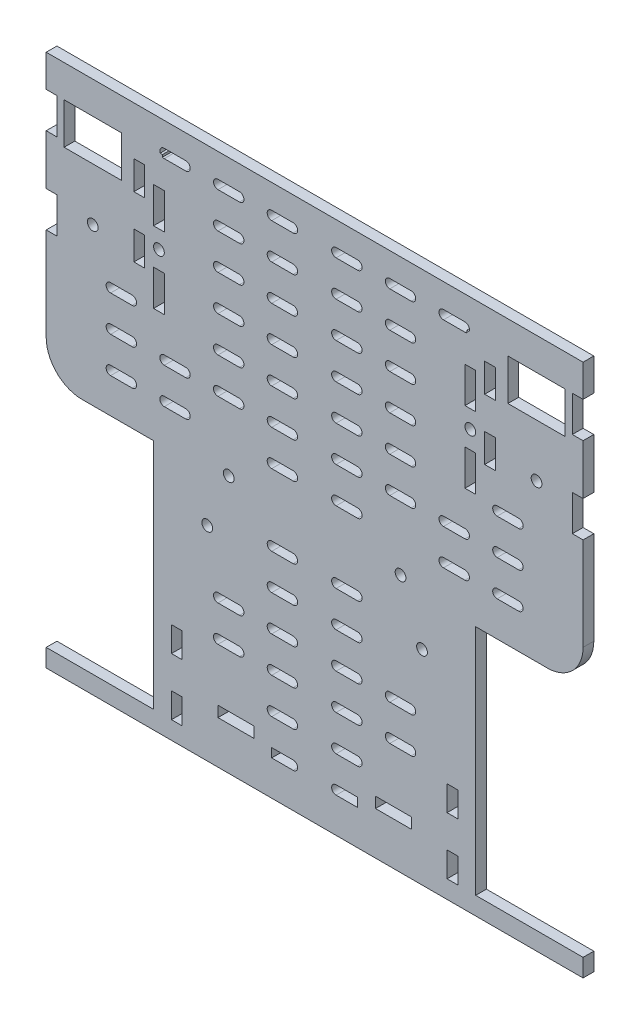
from build123d import *

# Parameters (mm, degrees)
SALIENTE_EXTRUIR1_DEPTH = 3
CROQUIS19_R             = 1.5
CROQUIS19_W             = 16
CROQUIS19_H             = 11.5
CORTAR_EXTRUIR5_DEPTH   = 5
CROQUIS35_W             = 3
CROQUIS35_H             = 7
CROQUIS35_W_2           = 10
CROQUIS35_H_2           = 3
CORTAR_EXTRUIR7_DEPTH   = 3
CROQUIS36_W             = 3
CROQUIS36_H             = 10
CORTAR_EXTRUIR8_DEPTH   = 3
CROQUIS37_R             = 1.5
CROQUIS37_W             = 3
CROQUIS37_H             = 10
CORTAR_EXTRUIR9_DEPTH   = 5
CROQUIS38_W             = 3
CROQUIS38_H             = 8
CORTAR_EXTRUIR10_DEPTH  = 10
CROQUIS45_R             = 1.5
CORTAR_EXTRUIR14_DEPTH  = 107.108435103
REDONDEO1_R             = 10
CORTAR_EXTRUIR11_DEPTH  = 10
CORTAR_EXTRUIR12_DEPTH  = 10
CROQUIS46_W             = 150
CROQUIS46_H             = 1
CORTAR_EXTRUIR15_DEPTH  = 107.108435103


with BuildPart() as part:
    # Croquis3 → Saliente-Extruir1 (new body)
    with BuildSketch(Plane.XY):
        Polygon((-75, -75), (75, -75), (75, -70), (45, -70), (45, -5), (75, -5), (75, 75), (-75, 75), (-75, -5), (-45, -5), (-45, -70), (-75, -70), align=None)
    extrude(amount=SALIENTE_EXTRUIR1_DEPTH)

    # Croquis19 → Cortar-Extruir5 (cut)
    with BuildSketch(Plane.XY):
        with Locations((-62, 38.75)):
            Circle(CROQUIS19_R)
        with Locations((-62, 59.25)):
            Rectangle(CROQUIS19_W, CROQUIS19_H)
    cortar_extruir5 = extrude(amount=CORTAR_EXTRUIR5_DEPTH, mode=Mode.SUBTRACT)

    # Croquis35 → Cortar-Extruir7 (cut)
    with BuildSketch(Plane.XY):
        with Locations((-38.5, -50.5)):
            Rectangle(CROQUIS35_W, CROQUIS35_H)
        with Locations((-38.5, -66.5)):
            Rectangle(CROQUIS35_W, CROQUIS35_H)
        with Locations((-22, -61.5)):
            Rectangle(CROQUIS35_W_2, CROQUIS35_H_2)
    cortar_extruir7 = extrude(amount=CORTAR_EXTRUIR7_DEPTH, mode=Mode.SUBTRACT)

    # Croquis36 → Cortar-Extruir8 (cut)
    with BuildSketch(Plane.XY):
        with Locations((-73.5, 60)):
            Rectangle(CROQUIS36_W, CROQUIS36_H)
        with Locations((-73.5, 36)):
            Rectangle(CROQUIS36_W, CROQUIS36_H)
    cortar_extruir8 = extrude(amount=CORTAR_EXTRUIR8_DEPTH, mode=Mode.SUBTRACT)

    # Croquis37 → Cortar-Extruir9 (cut)
    with BuildSketch(Plane.XY):
        with Locations((-43.5, 42)):
            Circle(CROQUIS37_R)
        with Locations((-43.5, 52)):
            Rectangle(CROQUIS37_W, CROQUIS37_H)
        with Locations((-43.5, 32)):
            Rectangle(CROQUIS37_W, CROQUIS37_H)
    cortar_extruir9 = extrude(amount=CORTAR_EXTRUIR9_DEPTH, mode=Mode.SUBTRACT)

    # Croquis38 → Cortar-Extruir10 (cut)
    with BuildSketch(Plane.XY):
        with Locations((-49, 56.5)):
            Rectangle(CROQUIS38_W, CROQUIS38_H)
        with Locations((-49, 39.5)):
            Rectangle(CROQUIS38_W, CROQUIS38_H)
    cortar_extruir10 = extrude(amount=CORTAR_EXTRUIR10_DEPTH, mode=Mode.SUBTRACT)

    # Croquis45 → Cortar-Extruir14 (cut, through all)
    with BuildSketch(Plane.XY):
        with Locations((24, -3)):
            Circle(CROQUIS45_R)
        with Locations((30, -18)):
            Circle(CROQUIS45_R)
    cortar_extruir14 = extrude(amount=CORTAR_EXTRUIR14_DEPTH, mode=Mode.SUBTRACT)

    # Simetría1: Cortar-Extruir5, Cortar-Extruir7, Cortar-Extruir8, Cortar-Extruir9, Cortar-Extruir10, Cortar-Extruir14 across plane
    add(cortar_extruir5.mirror(Plane(origin=(0, 0, 0), x_dir=(0, 0, 1), z_dir=(1, 0, 0))), mode=Mode.SUBTRACT)
    add(cortar_extruir7.mirror(Plane(origin=(0, 0, 0), x_dir=(0, 0, 1), z_dir=(1, 0, 0))), mode=Mode.SUBTRACT)
    add(cortar_extruir8.mirror(Plane(origin=(0, 0, 0), x_dir=(0, 0, 1), z_dir=(1, 0, 0))), mode=Mode.SUBTRACT)
    add(cortar_extruir9.mirror(Plane(origin=(0, 0, 0), x_dir=(0, 0, 1), z_dir=(1, 0, 0))), mode=Mode.SUBTRACT)
    add(cortar_extruir10.mirror(Plane(origin=(0, 0, 0), x_dir=(0, 0, 1), z_dir=(1, 0, 0))), mode=Mode.SUBTRACT)
    add(cortar_extruir14.mirror(Plane(origin=(0, 0, 0), x_dir=(0, 0, 1), z_dir=(1, 0, 0))), mode=Mode.SUBTRACT)

    # Redondeo1
    redondeo1_edges = [part.edges().sort_by_distance(p)[0] for p in [
        (-75, -5, 1.5),
        (75, -5, 1.5),
    ]]
    fillet(redondeo1_edges, radius=REDONDEO1_R)

    # Croquis42 → Cortar-Extruir11 (cut)
    with BuildSketch(Plane.XY):
        with BuildLine():
            Line((6, 7.25), (12, 7.25))
            ThreePointArc((12, 7.25), (13.25, 6), (12, 4.75))
            Line((12, 4.75), (6, 4.75))
            ThreePointArc((6, 4.75), (4.75, 6), (6, 7.25))
        make_face()
        with BuildLine():
            Line((36, 7.25), (42, 7.25))
            ThreePointArc((42, 7.25), (43.25, 6), (42, 4.75))
            Line((42, 4.75), (36, 4.75))
            ThreePointArc((36, 4.75), (34.75, 6), (36, 7.25))
        make_face()
        with BuildLine():
            Line((51, 7.25), (57, 7.25))
            ThreePointArc((57, 7.25), (58.25, 6), (57, 4.75))
            Line((57, 4.75), (51, 4.75))
            ThreePointArc((51, 4.75), (49.75, 6), (51, 7.25))
        make_face()
        with BuildLine():
            Line((21, 17.25), (27, 17.25))
            ThreePointArc((27, 17.25), (28.25, 16), (27, 14.75))
            Line((27, 14.75), (21, 14.75))
            ThreePointArc((21, 14.75), (19.75, 16), (21, 17.25))
        make_face()
        with BuildLine():
            Line((36, 17.25), (42, 17.25))
            ThreePointArc((42, 17.25), (43.25, 16), (42, 14.75))
            Line((42, 14.75), (36, 14.75))
            ThreePointArc((36, 14.75), (34.75, 16), (36, 17.25))
        make_face()
        with BuildLine():
            Line((51, 17.25), (57, 17.25))
            ThreePointArc((57, 17.25), (58.25, 16), (57, 14.75))
            Line((57, 14.75), (51, 14.75))
            ThreePointArc((51, 14.75), (49.75, 16), (51, 17.25))
        make_face()
        with BuildLine():
            Line((21, 27.25), (27, 27.25))
            ThreePointArc((27, 27.25), (28.25, 26), (27, 24.75))
            Line((27, 24.75), (21, 24.75))
            ThreePointArc((21, 24.75), (19.75, 26), (21, 27.25))
        make_face()
        with BuildLine():
            Line((51, 27.25), (57, 27.25))
            ThreePointArc((57, 27.25), (58.25, 26), (57, 24.75))
            Line((57, 24.75), (51, 24.75))
            ThreePointArc((51, 24.75), (49.75, 26), (51, 27.25))
        make_face()
        with BuildLine():
            Line((21, 57.25), (27, 57.25))
            ThreePointArc((27, 57.25), (28.25, 56), (27, 54.75))
            Line((27, 54.75), (21, 54.75))
            ThreePointArc((21, 54.75), (19.75, 56), (21, 57.25))
        make_face()
        with BuildLine():
            Line((42.5, 65.5), (42.5, 64.854356076))
            ThreePointArc((42.5, 64.854356076), (42.255387055, 64.776367109), (42, 64.75))
            Line((42, 64.75), (36, 64.75))
            ThreePointArc((36, 64.75), (34.75, 66), (36, 67.25))
            Line((36, 67.25), (42, 67.25))
            ThreePointArc((42, 67.25), (43.045825033, 66.684653197), (43.145643924, 65.5))
            Line((43.145643924, 65.5), (42.5, 65.5))
        make_face()
        with BuildLine():
            Line((21, 67.25), (27, 67.25))
            ThreePointArc((27, 67.25), (28.25, 66), (27, 64.75))
            Line((27, 64.75), (21, 64.75))
            ThreePointArc((21, 64.75), (19.75, 66), (21, 67.25))
        make_face()
        with BuildLine():
            Line((6, 17.25), (12, 17.25))
            ThreePointArc((12, 17.25), (13.25, 16), (12, 14.75))
            Line((12, 14.75), (6, 14.75))
            ThreePointArc((6, 14.75), (4.75, 16), (6, 17.25))
        make_face()
        with BuildLine():
            Line((6, 27.25), (12, 27.25))
            ThreePointArc((12, 27.25), (13.25, 26), (12, 24.75))
            Line((12, 24.75), (6, 24.75))
            ThreePointArc((6, 24.75), (4.75, 26), (6, 27.25))
        make_face()
        with BuildLine():
            Line((6, 57.25), (12, 57.25))
            ThreePointArc((12, 57.25), (13.25, 56), (12, 54.75))
            Line((12, 54.75), (6, 54.75))
            ThreePointArc((6, 54.75), (4.75, 56), (6, 57.25))
        make_face()
        with BuildLine():
            Line((6, 67.25), (12, 67.25))
            ThreePointArc((12, 67.25), (13.25, 66), (12, 64.75))
            Line((12, 64.75), (6, 64.75))
            ThreePointArc((6, 64.75), (4.75, 66), (6, 67.25))
        make_face()
        with BuildLine():
            Line((6, 47.25), (12, 47.25))
            ThreePointArc((12, 47.25), (13.25, 46), (12, 44.75))
            Line((12, 44.75), (6, 44.75))
            ThreePointArc((6, 44.75), (4.75, 46), (6, 47.25))
        make_face()
        with BuildLine():
            Line((6, 37.25), (12, 37.25))
            ThreePointArc((12, 37.25), (13.25, 36), (12, 34.75))
            Line((12, 34.75), (6, 34.75))
            ThreePointArc((6, 34.75), (4.75, 36), (6, 37.25))
        make_face()
        with BuildLine():
            Line((21, 47.25), (27, 47.25))
            ThreePointArc((27, 47.25), (28.25, 46), (27, 44.75))
            Line((27, 44.75), (21, 44.75))
            ThreePointArc((21, 44.75), (19.75, 46), (21, 47.25))
        make_face()
        with BuildLine():
            Line((21, 37.25), (27, 37.25))
            ThreePointArc((27, 37.25), (28.25, 36), (27, 34.75))
            Line((27, 34.75), (21, 34.75))
            ThreePointArc((21, 34.75), (19.75, 36), (21, 37.25))
        make_face()
    cortar_extruir11 = extrude(amount=CORTAR_EXTRUIR11_DEPTH, mode=Mode.SUBTRACT)

    # Simetría2: Cortar-Extruir11 across plane
    add(cortar_extruir11.mirror(Plane(origin=(0, 0, 0), x_dir=(0, 0, 1), z_dir=(1, 0, 0))), mode=Mode.SUBTRACT)

    # Croquis43 → Cortar-Extruir12 (cut)
    with BuildSketch(Plane.XY):
        with BuildLine():
            Line((6, 4.75), (12, 4.75))
            ThreePointArc((12, 4.75), (13.25, 6), (12, 7.25))
            Line((12, 7.25), (6, 7.25))
            ThreePointArc((6, 7.25), (4.75, 6), (6, 4.75))
        make_face()
        with BuildLine():
            Line((-12, 4.75), (-6, 4.75))
            ThreePointArc((-6, 4.75), (-4.75, 6), (-6, 7.25))
            Line((-6, 7.25), (-12, 7.25))
            ThreePointArc((-12, 7.25), (-13.25, 6), (-12, 4.75))
        make_face()
        with BuildLine():
            Line((-6, -12.75), (-12, -12.75))
            ThreePointArc((-12, -12.75), (-13.25, -14), (-12, -15.25))
            Line((-12, -15.25), (-6, -15.25))
            ThreePointArc((-6, -15.25), (-4.75, -14), (-6, -12.75))
        make_face()
        with BuildLine():
            Line((12, -12.75), (6, -12.75))
            ThreePointArc((6, -12.75), (4.75, -14), (6, -15.25))
            Line((6, -15.25), (12, -15.25))
            ThreePointArc((12, -15.25), (13.25, -14), (12, -12.75))
        make_face()
        with BuildLine():
            Line((-6, -22.75), (-12, -22.75))
            ThreePointArc((-12, -22.75), (-13.25, -24), (-12, -25.25))
            Line((-12, -25.25), (-6, -25.25))
            ThreePointArc((-6, -25.25), (-4.75, -24), (-6, -22.75))
        make_face()
        with BuildLine():
            Line((12, -22.75), (6, -22.75))
            ThreePointArc((6, -22.75), (4.75, -24), (6, -25.25))
            Line((6, -25.25), (12, -25.25))
            ThreePointArc((12, -25.25), (13.25, -24), (12, -22.75))
        make_face()
        with BuildLine():
            Line((-6, -32.75), (-12, -32.75))
            ThreePointArc((-12, -32.75), (-13.25, -34), (-12, -35.25))
            Line((-12, -35.25), (-6, -35.25))
            ThreePointArc((-6, -35.25), (-4.75, -34), (-6, -32.75))
        make_face()
        with BuildLine():
            Line((12, -32.75), (6, -32.75))
            ThreePointArc((6, -32.75), (4.75, -34), (6, -35.25))
            Line((6, -35.25), (12, -35.25))
            ThreePointArc((12, -35.25), (13.25, -34), (12, -32.75))
        make_face()
        with BuildLine():
            Line((-6, -42.75), (-12, -42.75))
            ThreePointArc((-12, -42.75), (-13.25, -44), (-12, -45.25))
            Line((-12, -45.25), (-6, -45.25))
            ThreePointArc((-6, -45.25), (-4.75, -44), (-6, -42.75))
        make_face()
        with BuildLine():
            Line((12, -42.75), (6, -42.75))
            ThreePointArc((6, -42.75), (4.75, -44), (6, -45.25))
            Line((6, -45.25), (12, -45.25))
            ThreePointArc((12, -45.25), (13.25, -44), (12, -42.75))
        make_face()
        with BuildLine():
            Line((-6, -52.75), (-12, -52.75))
            ThreePointArc((-12, -52.75), (-13.25, -54), (-12, -55.25))
            Line((-12, -55.25), (-6, -55.25))
            ThreePointArc((-6, -55.25), (-4.75, -54), (-6, -52.75))
        make_face()
        with BuildLine():
            Line((12, -52.75), (6, -52.75))
            ThreePointArc((6, -52.75), (4.75, -54), (6, -55.25))
            Line((6, -55.25), (12, -55.25))
            ThreePointArc((12, -55.25), (13.25, -54), (12, -52.75))
        make_face()
        with BuildLine():
            Line((-6, -62.75), (-12, -62.75))
            Line((-12, -62.75), (-12, -65.25))
            Line((-12, -65.25), (-6, -65.25))
            ThreePointArc((-6, -65.25), (-4.75, -64), (-6, -62.75))
        make_face()
        with BuildLine():
            Line((12, -62.75), (6, -62.75))
            ThreePointArc((6, -62.75), (4.75, -64), (6, -65.25))
            Line((6, -65.25), (12, -65.25))
            Line((12, -65.25), (12, -62.75))
        make_face()
        with BuildLine():
            Line((-21, -42.75), (-27, -42.75))
            ThreePointArc((-27, -42.75), (-28.25, -44), (-27, -45.25))
            Line((-27, -45.25), (-21, -45.25))
            ThreePointArc((-21, -45.25), (-19.75, -44), (-21, -42.75))
        make_face()
        with BuildLine():
            Line((27, -42.75), (21, -42.75))
            ThreePointArc((21, -42.75), (19.75, -44), (21, -45.25))
            Line((21, -45.25), (27, -45.25))
            ThreePointArc((27, -45.25), (28.25, -44), (27, -42.75))
        make_face()
        with BuildLine():
            Line((-21, -32.75), (-27, -32.75))
            ThreePointArc((-27, -32.75), (-28.25, -34), (-27, -35.25))
            Line((-27, -35.25), (-21, -35.25))
            ThreePointArc((-21, -35.25), (-19.75, -34), (-21, -32.75))
        make_face()
        with BuildLine():
            Line((27, -32.75), (21, -32.75))
            ThreePointArc((21, -32.75), (19.75, -34), (21, -35.25))
            Line((21, -35.25), (27, -35.25))
            ThreePointArc((27, -35.25), (28.25, -34), (27, -32.75))
        make_face()
    extrude(amount=CORTAR_EXTRUIR12_DEPTH, mode=Mode.SUBTRACT)

    # Croquis46 → Cortar-Extruir15 (cut, through all)
    with BuildSketch(Plane.XY):
        with Locations((0, 74.5)):
            Rectangle(CROQUIS46_W, CROQUIS46_H)
    extrude(amount=CORTAR_EXTRUIR15_DEPTH, mode=Mode.SUBTRACT)


solid = part.part
